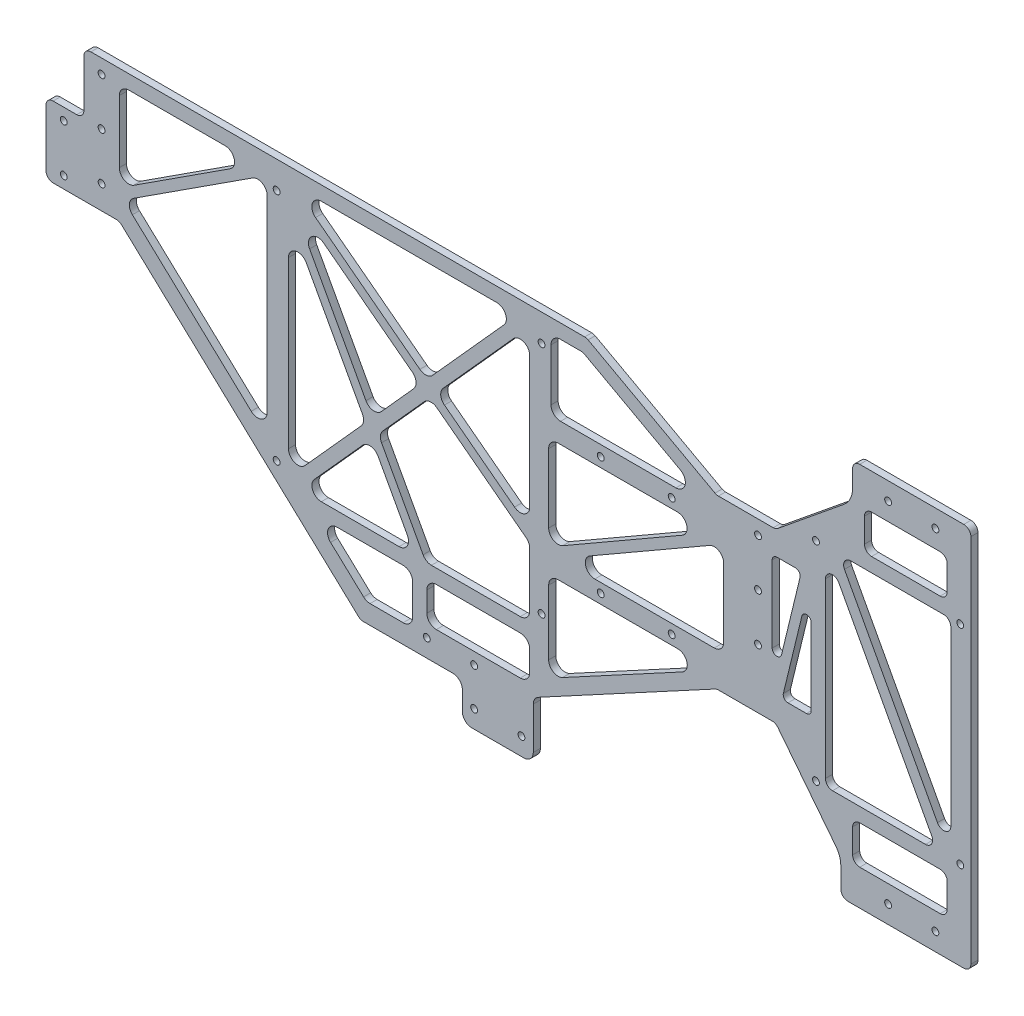
from build123d import *

# Parameters (mm, degrees)
SKETCH_1_R          = 1.45
SKETCH_1_W          = 102
SKETCH_1_H          = 110
SKETCH_1_W_2        = 74
SKETCH_1_H_2        = 42
SKETCH_1_W_3        = 43.5
SKETCH_1_H_3        = 16.5
SKETCH_1_W_4        = 53
SKETCH_1_H_4        = 88
EXTRUDE_1_DEPTH     = 3
EXTRUDE_2_DEPTH     = 3
EXTRUDE_3_DEPTH     = 3
FILLET_1_R          = 4
SKETCH_6_W          = 35
SKETCH_6_H          = 16.25
SKETCH_6_W_2        = 40
SKETCH_6_W_3        = 16.5
SKETCH_6_H_2        = 51
CUT_EXTRUDE_1_DEPTH = 3
EXTRUDE_4_DEPTH     = 3
FILLET_2_R          = 2
FILLET_3_R          = 3
FILLET_4_R          = 10
SKETCH_8_W          = 16
SKETCH_8_H          = 30
SKETCH_8_R          = 1.45
EXTRUDE_5_DEPTH     = 3
FILLET_5_R          = 3
SKETCH_9_R          = 1.45
EXTRUDE_6_DEPTH     = 3
FILLET_6_R          = 4


with BuildPart() as part:
    # 草图1 → 凸台-拉伸1 (new body)
    with BuildSketch(Plane.XY):
        Polygon((-292.5, -94), (-80, -94), (-25, -124), (0, -124), (32.5, -97.5), (32.5, -82.5), (82.5, -82.5), (82.5, -245), (27.5, -245), (27.5, -230), (0, -195), (-25, -195), (-117.5, -245), (-175.5, -245), (-277.5, -150), (-292.5, -150), align=None)
        with Locations((-285, -100)):
            Circle(SKETCH_1_R, mode=Mode.SUBTRACT)
        with Locations((-285, -120)):
            Circle(SKETCH_1_R, mode=Mode.SUBTRACT)
        with Locations((-285, -140)):
            Circle(SKETCH_1_R, mode=Mode.SUBTRACT)
        with Locations((-147.5, -237.5)):
            Circle(SKETCH_1_R, mode=Mode.SUBTRACT)
        with Locations((-127.5, -237.5)):
            Circle(SKETCH_1_R, mode=Mode.SUBTRACT)
        with Locations((-7.5, -130)):
            Circle(SKETCH_1_R, mode=Mode.SUBTRACT)
        with Locations((-7.5, -150)):
            Circle(SKETCH_1_R, mode=Mode.SUBTRACT)
        with Locations((-211, -204.5)):
            Circle(SKETCH_1_R, mode=Mode.SUBTRACT)
        with Locations((-211, -105.5)):
            Circle(SKETCH_1_R, mode=Mode.SUBTRACT)
        with Locations((-99, -105.5)):
            Circle(SKETCH_1_R, mode=Mode.SUBTRACT)
        with Locations((-99, -204.5)):
            Circle(SKETCH_1_R, mode=Mode.SUBTRACT)
        with Locations((-74, -134.5)):
            Circle(SKETCH_1_R, mode=Mode.SUBTRACT)
        with Locations((-44, -134.5)):
            Circle(SKETCH_1_R, mode=Mode.SUBTRACT)
        with Locations((-74, -184.5)):
            Circle(SKETCH_1_R, mode=Mode.SUBTRACT)
        with Locations((-44, -184.5)):
            Circle(SKETCH_1_R, mode=Mode.SUBTRACT)
        with Locations((-7.5, -170)):
            Circle(SKETCH_1_R, mode=Mode.SUBTRACT)
        with Locations((47.5, -90)):
            Circle(SKETCH_1_R, mode=Mode.SUBTRACT)
        with Locations((67.5, -90)):
            Circle(SKETCH_1_R, mode=Mode.SUBTRACT)
        with Locations((47.5, -237.5)):
            Circle(SKETCH_1_R, mode=Mode.SUBTRACT)
        with Locations((67.5, -237.5)):
            Circle(SKETCH_1_R, mode=Mode.SUBTRACT)
        with Locations((17, -119.75)):
            Circle(SKETCH_1_R, mode=Mode.SUBTRACT)
        with Locations((78, -119.75)):
            Circle(SKETCH_1_R, mode=Mode.SUBTRACT)
        with Locations((78, -207.75)):
            Circle(SKETCH_1_R, mode=Mode.SUBTRACT)
        with Locations((17, -207.75)):
            Circle(SKETCH_1_R, mode=Mode.SUBTRACT)
        Polygon((-277.5, -100), (-277.5, -139.750886189), (-215, -197.961670503), (-215, -100), align=None, mode=Mode.SUBTRACT)
        with Locations((-155, -155)):
            Rectangle(SKETCH_1_W, SKETCH_1_H, mode=Mode.SUBTRACT)
        Polygon((-95, -100), (-95, -130), (-26.529964086, -130), (-81.529964086, -100), align=None, mode=Mode.SUBTRACT)
        with Locations((-59, -159.5)):
            Rectangle(SKETCH_1_W_2, SKETCH_1_H_2, mode=Mode.SUBTRACT)
        Polygon((-195.632530435, -216), (-153.5, -216), (-153.5, -237), (-173.085162013, -237), align=None, mode=Mode.SUBTRACT)
        Polygon((-96, -188.5), (-96, -226.557921888), (-25.592844507, -188.5), align=None, mode=Mode.SUBTRACT)
        with Locations((-125.75, -224.25)):
            Rectangle(SKETCH_1_W_3, SKETCH_1_H_3, mode=Mode.SUBTRACT)
        with Locations((47.5, -163.75)):
            Rectangle(SKETCH_1_W_4, SKETCH_1_H_4, mode=Mode.SUBTRACT)
    extrude(amount=EXTRUDE_1_DEPTH)

    # 草图3 → 凸台-拉伸2 (add)
    with BuildSketch(Plane.XY):
        Polygon((-206, -210), (-206, -208), (-108.925253737, -100), (-104, -100), (-104, -102), (-201.074746263, -210), align=None)
        Polygon((-277.5, -137.750886189), (-219.268194016, -100), (-215, -100), (-215, -102), (-275.748348441, -141.382326366), (-277.5, -139.750886189), align=None)
        Polygon((-22, -138.5), (-26.542331912, -138.5), (-96, -178.5), (-96, -180.5), (-91.457668088, -180.5), (-22, -140.5), align=None)
    extrude(amount=EXTRUDE_2_DEPTH)

    # 草图4 → 凸台-拉伸3 (add)
    with BuildSketch(Plane.XY):
        Polygon((-206, -103.50410191), (-206, -100), (-204, -100), (-104, -176), (-104, -181.02410191), align=None)
        Polygon((-206, -111.861061309), (-206, -103.50410191), (-147.944241258, -210), (-152.5, -210), align=None)
    extrude(amount=EXTRUDE_3_DEPTH)

    # 圆角1
    fillet_1_edges = [part.edges().sort_by_distance(p)[0] for p in [
        (-104, -210, 1.5),
        (-277.5, -100, 1.5),
        (-215, -197.961670503, 1.5),
        (-22, -180.5, 1.5),
        (-96, -138.5, 1.5),
        (-81.529964086, -100, 1.5),
        (-95, -100, 1.5),
        (-95, -130, 1.5),
        (-26.529964086, -130, 1.5),
        (-195.632530435, -216, 1.5),
        (-173.085162013, -237, 1.5),
        (-153.5, -237, 1.5),
        (-153.5, -216, 1.5),
        (-25.592844507, -188.5, 1.5),
        (-96, -188.5, 1.5),
        (-96, -226.557921888, 1.5),
        (-104, -216, 1.5),
        (-147.5, -216, 1.5),
        (-147.5, -232.5, 1.5),
        (-104, -232.5, 1.5),
        (-22, -140.5, 1.5),
        (-26.542331912, -138.5, 1.5),
        (-96, -178.5, 1.5),
        (-91.457668088, -180.5, 1.5),
        (-277.5, -137.750886189, 1.5),
        (-275.748348441, -141.382326366, 1.5),
        (-215, -102, 1.5),
        (-219.268194016, -100, 1.5),
        (-201.074746263, -210, 1.5),
        (-104, -102, 1.5),
        (-108.925253737, -100, 1.5),
        (-206, -208, 1.5),
        (-150.195780798, -145.915308504, 1.5),
        (-147.512746445, -142.930312702, 1.5),
        (-104, -176, 1.5),
        (-206, -103.50410191, 1.5),
        (-204, -100, 1.5),
        (-143.518414564, -145.966004931, 1.5),
        (-104, -181.02410191, 1.5),
        (-146.201448917, -148.951000733, 1.5),
        (-173.37643977, -171.704829109, 1.5),
        (-170.838341786, -176.360646726, 1.5),
        (-206, -111.861061309, 1.5),
        (-168.002510935, -173.20565798, 1.5),
        (-147.944241258, -210, 1.5),
        (-170.540608919, -168.549840364, 1.5),
        (-152.5, -210, 1.5),
    ]]
    fillet(fillet_1_edges, radius=FILLET_1_R)

    # 草图6 → 切除-拉伸1 (cut)
    with BuildSketch(Plane.XY.offset(3)):
        with Locations((55, -105.625)):
            Rectangle(SKETCH_6_W, SKETCH_6_H)
        with Locations((52.5, -221.875)):
            Rectangle(SKETCH_6_W_2, SKETCH_6_H)
        with Locations((6.75, -159.5)):
            Rectangle(SKETCH_6_W_3, SKETCH_6_H_2)
    extrude(amount=-CUT_EXTRUDE_1_DEPTH, mode=Mode.SUBTRACT)

    # 草图7 → 凸台-拉伸4 (add)
    with BuildSketch(Plane.XY):
        Polygon((21, -119.75), (68.32288395, -207.75), (74, -207.75), (26.67711605, -119.75), align=None)
        Polygon((15, -134), (10.883766684, -134), (-1.5, -185), (2.616233316, -185), align=None)
    extrude(amount=EXTRUDE_4_DEPTH)

    # 圆角2
    fillet_2_edges = [part.edges().sort_by_distance(p)[0] for p in [
        (-1.5, -185, 1.5),
        (-1.5, -134, 1.5),
        (15, -134, 1.5),
        (15, -185, 1.5),
        (2.616233316, -185, 1.5),
        (10.883766684, -134, 1.5),
    ]]
    fillet(fillet_2_edges, radius=FILLET_2_R)

    # 圆角3
    fillet_3_edges = [part.edges().sort_by_distance(p)[0] for p in [
        (74, -207.75, 1.5),
        (74, -119.75, 1.5),
        (21, -119.75, 1.5),
        (21, -207.75, 1.5),
        (37.5, -113.75, 1.5),
        (37.5, -97.5, 1.5),
        (72.5, -97.5, 1.5),
        (72.5, -113.75, 1.5),
        (32.5, -230, 1.5),
        (32.5, -213.75, 1.5),
        (72.5, -213.75, 1.5),
        (72.5, -230, 1.5),
        (26.67711605, -119.75, 1.5),
        (68.32288395, -207.75, 1.5),
    ]]
    fillet(fillet_3_edges, radius=FILLET_3_R)

    # 圆角4
    fillet_4_edges = [part.edges().sort_by_distance(p)[0] for p in [
        (32.5, -97.5, 1.5),
        (27.5, -230, 1.5),
    ]]
    fillet(fillet_4_edges, radius=FILLET_4_R)

    # 草图8 → 凸台-拉伸5 (add)
    with BuildSketch(Plane.XY):
        with Locations((-300.5, -135)):
            Rectangle(SKETCH_8_W, SKETCH_8_H)
        with Locations((-301, -145)):
            Circle(SKETCH_8_R, mode=Mode.SUBTRACT)
        with Locations((-301, -125)):
            Circle(SKETCH_8_R, mode=Mode.SUBTRACT)
    extrude(amount=EXTRUDE_5_DEPTH)

    # 圆角5
    fillet_5_edges = [part.edges().sort_by_distance(p)[0] for p in [
        (-292.5, -120, 1.5),
        (-308.5, -120, 1.5),
        (-308.5, -150, 1.5),
        (-292.5, -94, 1.5),
        (-80, -94, 1.5),
        (-25, -124, 1.5),
        (0, -124, 1.5),
        (32.5, -82.5, 1.5),
        (82.5, -82.5, 1.5),
        (82.5, -245, 1.5),
        (27.5, -245, 1.5),
        (0, -195, 1.5),
        (-25, -195, 1.5),
        (-117.5, -245, 1.5),
        (-175.5, -245, 1.5),
        (-277.5, -150, 1.5),
    ]]
    fillet(fillet_5_edges, radius=FILLET_5_R)

    # 草图9 → 凸台-拉伸6 (add)
    with BuildSketch(Plane.XY):
        Polygon((-132.5, -245), (-122.5, -245), (-102.5, -236.891891892), (-102.5, -261), (-132.5, -261), align=None)
        with Locations(Location((-127.5, -253.5, 0), (0, 0, 180))):
            Circle(SKETCH_9_R, mode=Mode.SUBTRACT)
        with Locations(Location((-107.5, -253.5, 0), (0, 0, 180))):
            Circle(SKETCH_9_R, mode=Mode.SUBTRACT)
    extrude(amount=EXTRUDE_6_DEPTH)

    # 圆角6
    fillet_6_edges = [part.edges().sort_by_distance(p)[0] for p in [
        (-102.5, -236.891891892, 1.5),
        (-102.5, -261, 1.5),
        (-132.5, -261, 1.5),
        (-132.5, -245, 1.5),
    ]]
    fillet(fillet_6_edges, radius=FILLET_6_R)


solid = part.part
